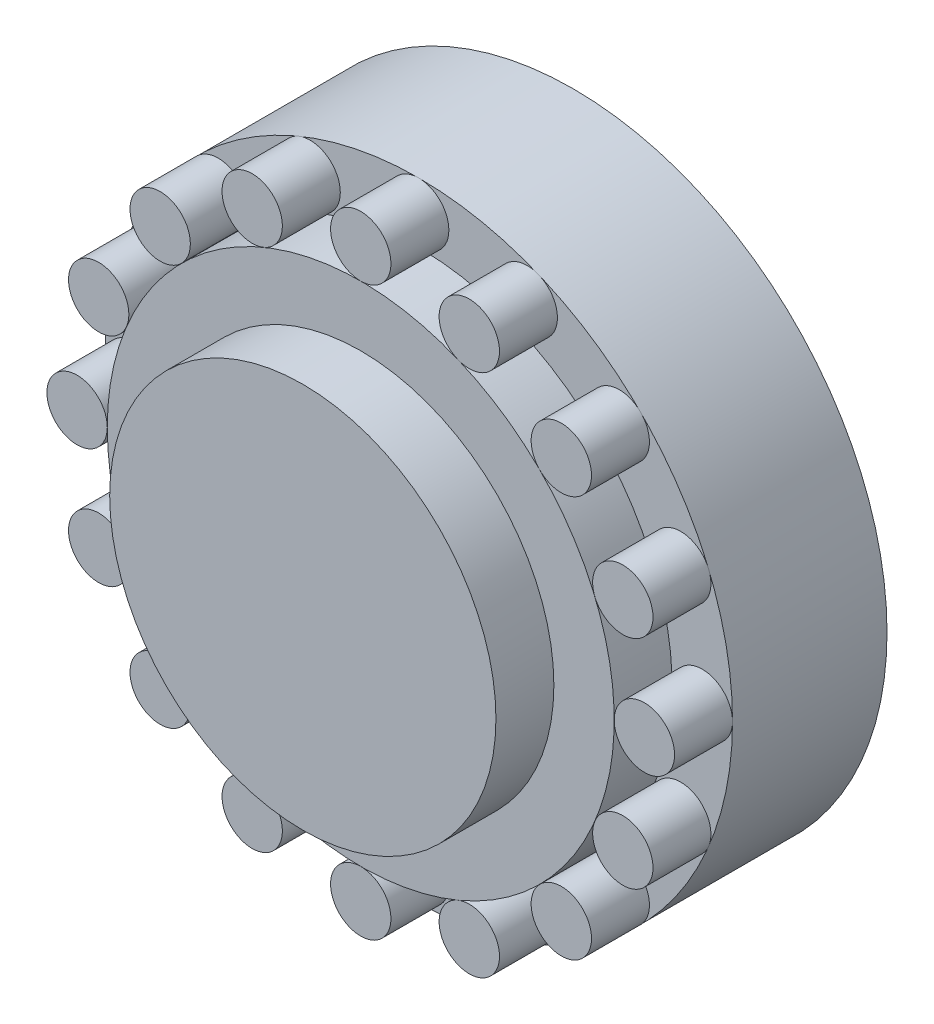
from build123d import *

# Parameters (mm, degrees)
SCHIZZO1_W                   = 20
SCHIZZO1_H                   = 6
SCHIZZO2_R                   = 3.125
AGGANCIWELDINGTORCH_DEPTH    = 6
AGGANCIWELDINGTORCH_2_DEPTH  = 6
AGGANCIWELDINGTORCH_3_DEPTH  = 6
AGGANCIWELDINGTORCH_4_DEPTH  = 6
AGGANCIWELDINGTORCH_5_DEPTH  = 6
AGGANCIWELDINGTORCH_6_DEPTH  = 6
AGGANCIWELDINGTORCH_7_DEPTH  = 6
AGGANCIWELDINGTORCH_8_DEPTH  = 6
AGGANCIWELDINGTORCH_9_DEPTH  = 6
AGGANCIWELDINGTORCH_10_DEPTH = 6
AGGANCIWELDINGTORCH_11_DEPTH = 6
AGGANCIWELDINGTORCH_12_DEPTH = 6
AGGANCIWELDINGTORCH_13_DEPTH = 6
AGGANCIWELDINGTORCH_14_DEPTH = 6
AGGANCIWELDINGTORCH_15_DEPTH = 6
AGGANCIWELDINGTORCH_16_DEPTH = 6


with BuildPart() as part:
    # Schizzo1 → Rivoluzione1 (revolve)
    with BuildSketch(Plane(origin=(0, 0, 0), x_dir=(1, 0, 0), z_dir=(0, 1, 0)), mode=Mode.PRIVATE) as rivoluzione1_sk:
        Polygon((32.5, 0), (0, 0), (0, -16), (26.25, -16), (32.5, -16), align=None)
        Polygon((26.25, -16), (0, -16), (0, -22), (20, -22), (26.25, -22), align=None)
        with Locations((10, -25)):
            Rectangle(SCHIZZO1_W, SCHIZZO1_H)
    revolve(rivoluzione1_sk.sketch.rotate(Axis((0, 0, -26.831100571), (0, 0, 1)), 180), axis=Axis((0, 0, -26.831100571), (0, 0, 1)))


with BuildPart() as body_2:
    # Schizzo2 → AgganciWeldingTorch (new body)
    with BuildSketch(Plane.XY.offset(16)):
        with Locations((-29.375, 0)):
            Circle(SCHIZZO2_R)
    extrude(amount=AGGANCIWELDINGTORCH_DEPTH)


with BuildPart() as body_3:
    # Schizzo2 → AgganciWeldingTorch 2 (new body)
    with BuildSketch(Plane.XY.offset(16)):
        with Locations((-27.139001091, 11.241229683)):
            Circle(SCHIZZO2_R)
    extrude(amount=AGGANCIWELDINGTORCH_2_DEPTH)


with BuildPart() as body_4:
    # Schizzo2 → AgganciWeldingTorch 3 (new body)
    with BuildSketch(Plane.XY.offset(16)):
        with Locations((-20.771375105, 20.77109197)):
            Circle(SCHIZZO2_R)
    extrude(amount=AGGANCIWELDINGTORCH_3_DEPTH)


with BuildPart() as body_5:
    # Schizzo2 → AgganciWeldingTorch 4 (new body)
    with BuildSketch(Plane.XY.offset(16)):
        with Locations((-11.241535377, 27.138751716)):
            Circle(SCHIZZO2_R)
    extrude(amount=AGGANCIWELDINGTORCH_4_DEPTH)


with BuildPart() as body_6:
    # Schizzo2 → AgganciWeldingTorch 5 (new body)
    with BuildSketch(Plane.XY.offset(16)):
        with Locations((-0.000313615, 29.374790448)):
            Circle(SCHIZZO2_R)
    extrude(amount=AGGANCIWELDINGTORCH_5_DEPTH)


with BuildPart() as body_7:
    # Schizzo2 → AgganciWeldingTorch 6 (new body)
    with BuildSketch(Plane.XY.offset(16)):
        with Locations((11.240916068, 27.138791539)):
            Circle(SCHIZZO2_R)
    extrude(amount=AGGANCIWELDINGTORCH_6_DEPTH)


with BuildPart() as body_8:
    # Schizzo2 → AgganciWeldingTorch 7 (new body)
    with BuildSketch(Plane.XY.offset(16)):
        with Locations((20.770778355, 20.771165554)):
            Circle(SCHIZZO2_R)
    extrude(amount=AGGANCIWELDINGTORCH_7_DEPTH)


with BuildPart() as body_9:
    # Schizzo2 → AgganciWeldingTorch 8 (new body)
    with BuildSketch(Plane.XY.offset(16)):
        with Locations((27.138438101, 11.241325825)):
            Circle(SCHIZZO2_R)
    extrude(amount=AGGANCIWELDINGTORCH_8_DEPTH)


with BuildPart() as body_10:
    # Schizzo2 → AgganciWeldingTorch 9 (new body)
    with BuildSketch(Plane.XY.offset(16)):
        with Locations((29.374476833, 0.000104063)):
            Circle(SCHIZZO2_R)
    extrude(amount=AGGANCIWELDINGTORCH_9_DEPTH)


with BuildPart() as body_11:
    # Schizzo2 → AgganciWeldingTorch 10 (new body)
    with BuildSketch(Plane.XY.offset(16)):
        with Locations((27.138477924, -11.241125619)):
            Circle(SCHIZZO2_R)
    extrude(amount=AGGANCIWELDINGTORCH_10_DEPTH)


with BuildPart() as body_12:
    # Schizzo2 → AgganciWeldingTorch 11 (new body)
    with BuildSketch(Plane.XY.offset(16)):
        with Locations((20.770851939, -20.770987906)):
            Circle(SCHIZZO2_R)
    extrude(amount=AGGANCIWELDINGTORCH_11_DEPTH)


with BuildPart() as body_13:
    # Schizzo2 → AgganciWeldingTorch 12 (new body)
    with BuildSketch(Plane.XY.offset(16)):
        with Locations((11.24101221, -27.138647653)):
            Circle(SCHIZZO2_R)
    extrude(amount=AGGANCIWELDINGTORCH_12_DEPTH)


with BuildPart() as body_14:
    # Schizzo2 → AgganciWeldingTorch 13 (new body)
    with BuildSketch(Plane.XY.offset(16)):
        with Locations((-0.000209552, -29.374686385)):
            Circle(SCHIZZO2_R)
    extrude(amount=AGGANCIWELDINGTORCH_13_DEPTH)


with BuildPart() as body_15:
    # Schizzo2 → AgganciWeldingTorch 14 (new body)
    with BuildSketch(Plane.XY.offset(16)):
        with Locations((-11.241439234, -27.138687476)):
            Circle(SCHIZZO2_R)
    extrude(amount=AGGANCIWELDINGTORCH_14_DEPTH)


with BuildPart() as body_16:
    # Schizzo2 → AgganciWeldingTorch 15 (new body)
    with BuildSketch(Plane.XY.offset(16)):
        with Locations((-20.771301521, -20.77106149)):
            Circle(SCHIZZO2_R)
    extrude(amount=AGGANCIWELDINGTORCH_15_DEPTH)


with BuildPart() as body_17:
    # Schizzo2 → AgganciWeldingTorch 16 (new body)
    with BuildSketch(Plane.XY.offset(16)):
        with Locations((-27.138961268, -11.241221761)):
            Circle(SCHIZZO2_R)
    extrude(amount=AGGANCIWELDINGTORCH_16_DEPTH)


solid = Compound([part.part, body_2.part, body_3.part, body_4.part, body_5.part, body_6.part, body_7.part, body_8.part, body_9.part, body_10.part, body_11.part, body_12.part, body_13.part, body_14.part, body_15.part, body_16.part, body_17.part])
